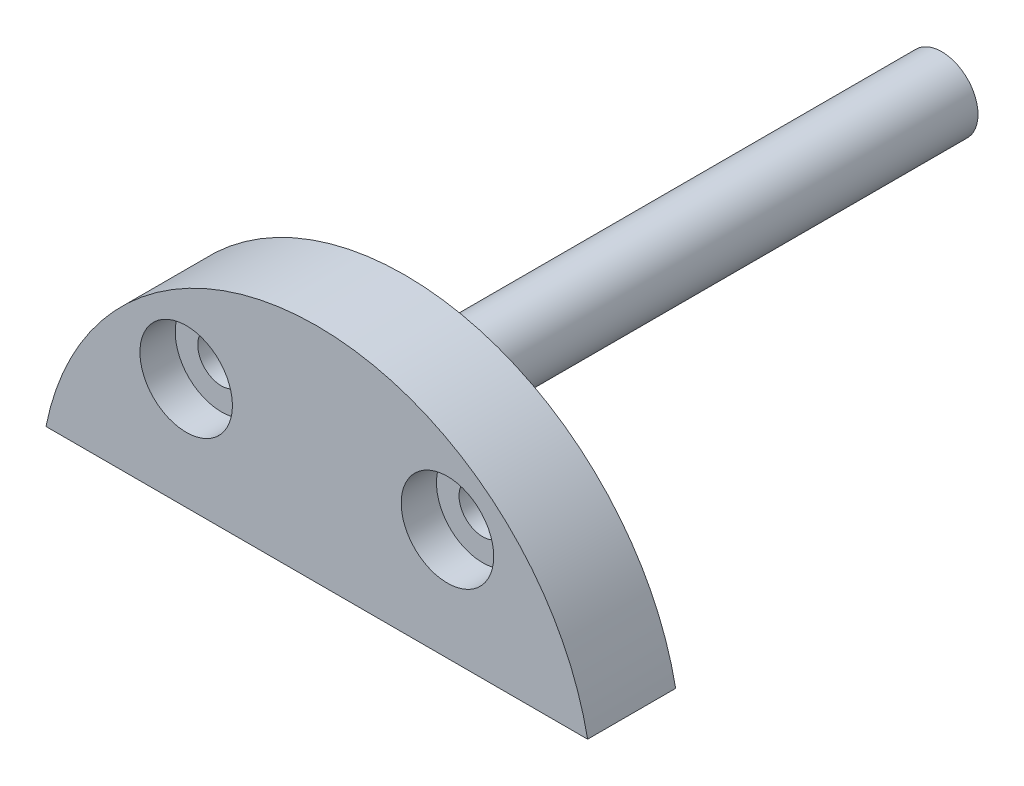
from build123d import *

# Parameters (mm, degrees)
SALIENTE_EXTRUIR1_DEPTH = 9.66
CROQUIS2_R              = 3.98
SALIENTE_EXTRUIR2_DEPTH = 58.91
CORTAR_EXTRUIR1_REACH   = 80.623
CROQUIS3_R              = 2.6
CROQUIS4_R              = 5.075
CORTAR_EXTRUIR2_DEPTH   = 3.87


with BuildPart() as part:
    # Croquis1 → Saliente-Extruir1 (new body)
    with BuildSketch(Plane.XY):
        with BuildLine():
            Line((-29.715, 0), (29.715, 0))
            ThreePointArc((29.715, 0), (0, 24.43), (-29.715, 0))
        make_face()
    extrude(amount=-SALIENTE_EXTRUIR1_DEPTH)

    # Croquis2 → Saliente-Extruir2 (add)
    with BuildSketch(Plane(origin=(0, 0, -9.66), x_dir=(-1, 0, 0), z_dir=(0, 0, -1))):
        with Locations(Location((0, 12.215, 0), (0, 0, 180))):
            Circle(CROQUIS2_R)
    extrude(amount=SALIENTE_EXTRUIR2_DEPTH)

    # Croquis3 → Cortar-Extruir1 (cut, up to next)
    with BuildSketch(Plane.XY, mode=Mode.PRIVATE) as cortar_extruir1_sk1:
        with Locations((-14.334085257, 12.215)):
            Circle(CROQUIS3_R)
    cortar_extruir1_tool1 = extrude(cortar_extruir1_sk1.sketch, amount=-CORTAR_EXTRUIR1_REACH, mode=Mode.PRIVATE) & part.part
    # Croquis3 → Cortar-Extruir1 (cut, up to next)
    with BuildSketch(Plane.XY, mode=Mode.PRIVATE) as cortar_extruir1_sk2:
        with Locations((14.334085257, 12.215)):
            Circle(CROQUIS3_R)
    cortar_extruir1_tool2 = extrude(cortar_extruir1_sk2.sketch, amount=-CORTAR_EXTRUIR1_REACH, mode=Mode.PRIVATE) & part.part
    add(cortar_extruir1_tool1.solids().sort_by_distance((-14.334085, 12.215, 0))[0], mode=Mode.SUBTRACT)
    add(cortar_extruir1_tool2.solids().sort_by_distance((14.334085, 12.215, 0))[0], mode=Mode.SUBTRACT)

    # Croquis4 → Cortar-Extruir2 (cut)
    with BuildSketch(Plane.XY):
        with Locations((14.334085257, 12.215)):
            Circle(CROQUIS4_R)
        with Locations((-14.334085257, 12.215)):
            Circle(CROQUIS4_R)
    extrude(amount=-CORTAR_EXTRUIR2_DEPTH, mode=Mode.SUBTRACT)


solid = part.part
